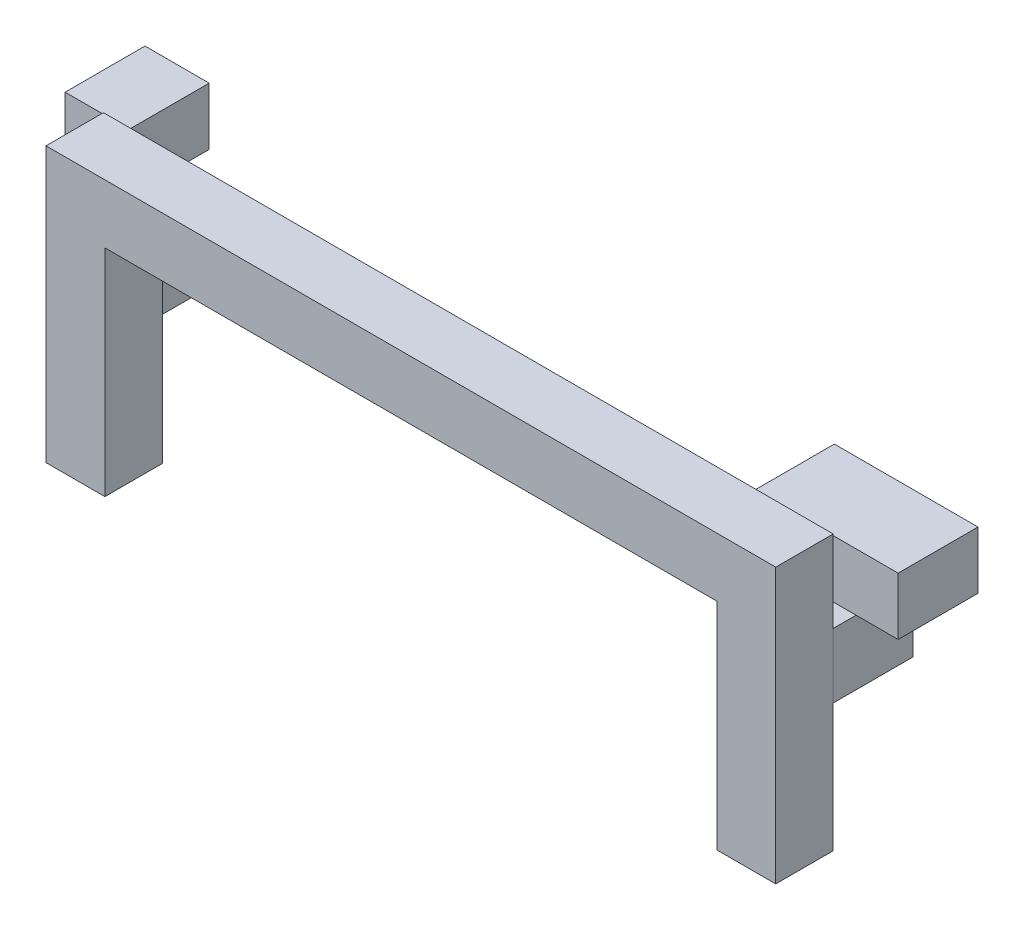
from build123d import *

# Parameters (mm, degrees)
SKETCH2_W           = 254
SKETCH2_H           = 41
BOSS_EXTRUDE1_DEPTH = 40
SKETCH3_W           = 44.69
SKETCH3_H           = 40
BOSS_EXTRUDE6_DEPTH = 55.6
SKETCH7_W           = 100
SKETCH7_H           = 40
BOSS_EXTRUDE7_DEPTH = 55.6
SKETCH8_W           = 41
SKETCH8_H           = 40
BOSS_EXTRUDE8_DEPTH = 150
SKETCH9_W           = 40
SKETCH9_H           = 45
BOSS_EXTRUDE9_DEPTH = 55.6


with BuildPart() as part:
    # Sketch2 → Boss-Extrude1 (new body)
    with BuildSketch(Plane.XY):
        with Locations((-241.745614035, -30.596491228)):
            Rectangle(SKETCH2_W, SKETCH2_H)
        with Locations((12.254385965, -30.596491228)):
            Rectangle(SKETCH2_W, SKETCH2_H)
    extrude(amount=BOSS_EXTRUDE1_DEPTH)

    # Sketch3 → Boss-Extrude6 (add)
    with BuildSketch(Plane(origin=(0, 0, 0), x_dir=(-1, 0, 0), z_dir=(0, 0, -1))):
        with Locations((373.090614035, -31.096491228)):
            Rectangle(SKETCH3_W, SKETCH3_H)
    extrude(amount=BOSS_EXTRUDE6_DEPTH)

    # Sketch7 → Boss-Extrude7 (add)
    with BuildSketch(Plane(origin=(0, 0, 0), x_dir=(-1, 0, 0), z_dir=(0, 0, -1))):
        with Locations((-134.464385965, -31.096491228)):
            Rectangle(SKETCH7_W, SKETCH7_H)
    extrude(amount=BOSS_EXTRUDE7_DEPTH)

    # Sketch8 → Boss-Extrude8 (add)
    with BuildSketch(Plane.XZ.offset(51.096491228)):
        with Locations((118.754385965, 20)):
            Rectangle(SKETCH8_W, SKETCH8_H)
        with Locations((-348.245614035, 20)):
            Rectangle(SKETCH8_W, SKETCH8_H)
    extrude(amount=BOSS_EXTRUDE8_DEPTH)

    # Sketch9 → Boss-Extrude9 (add)
    with BuildSketch(Plane(origin=(0, 0, 0), x_dir=(-1, 0, 0), z_dir=(0, 0, -1))):
        with Locations((-119.154385965, -89.642057698)):
            Rectangle(SKETCH9_W, SKETCH9_H)
        with Locations((348.645614035, -89.642057698)):
            Rectangle(SKETCH9_W, SKETCH9_H)
    extrude(amount=BOSS_EXTRUDE9_DEPTH)


solid = part.part
